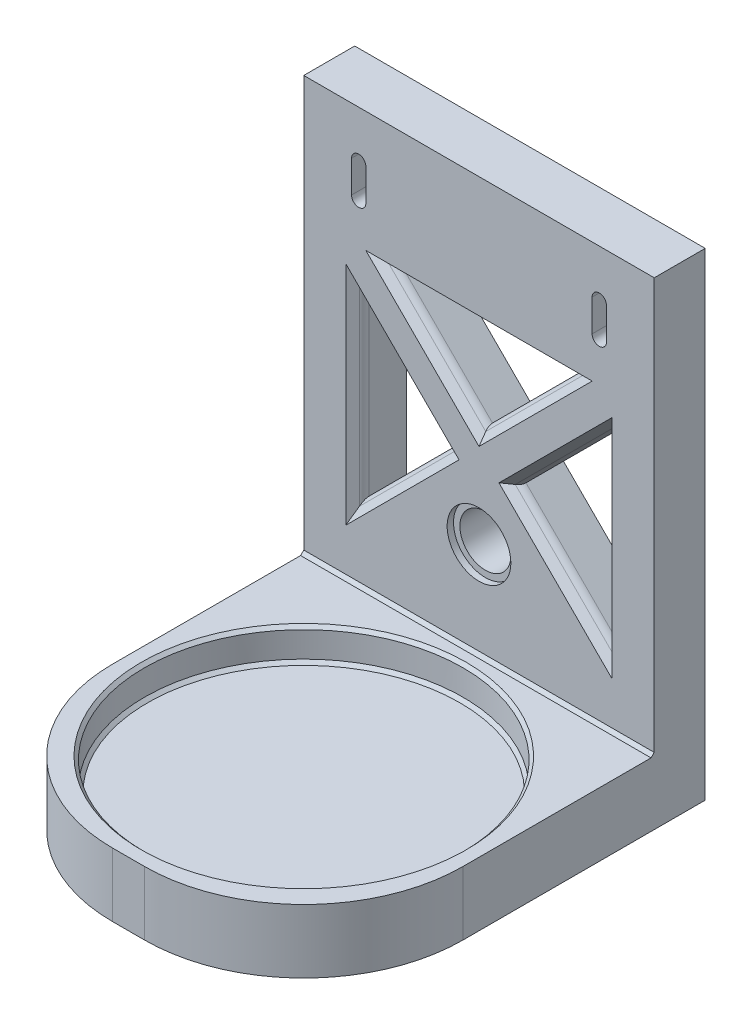
from build123d import *

# Parameters (mm, degrees)
SKETCH1_W           = 110
SKETCH1_H           = 150
BOSS_EXTRUDE1_DEPTH = 16
SKETCH4_W           = 110
SKETCH4_H           = 110
BOSS_EXTRUDE2_DEPTH = 20
SKETCH6_R           = 50
CUT_EXTRUDE1_DEPTH  = 10
FILLET1_R           = 50
SKETCH7_R           = 8
CUT_EXTRUDE4_DEPTH  = 194.971647413
SKETCH5_R           = 10
CUT_EXTRUDE5_DEPTH  = 2
CHAMFER3_SIZE       = 1
CHAMFER4_SIZE       = 1
CUT_EXTRUDE7_DEPTH  = 194.971647413
CHAMFER6_SIZE       = 3
FILLET3_R           = 3


with BuildPart() as part:
    # Sketch1 → Boss-Extrude1 (new body)
    with BuildSketch(Plane.XY):
        with Locations((0, 75)):
            Rectangle(SKETCH1_W, SKETCH1_H)
        with BuildLine():
            Line((-35.5, 135), (-35.5, 125))
            ThreePointArc((-35.5, 125), (-37.75, 122.75), (-40, 125))
            Line((-40, 125), (-40, 135))
            ThreePointArc((-40, 135), (-37.75, 137.25), (-35.5, 135))
        make_face(mode=Mode.SUBTRACT)
        with BuildLine():
            Line((35.5, 135), (35.5, 125))
            ThreePointArc((35.5, 125), (37.75, 122.75), (40, 125))
            Line((40, 125), (40, 135))
            ThreePointArc((40, 135), (37.75, 137.25), (35.5, 135))
        make_face(mode=Mode.SUBTRACT)
    extrude(amount=BOSS_EXTRUDE1_DEPTH)

    # Sketch4 → Boss-Extrude2 (add)
    with BuildSketch(Plane(origin=(0, 0, 0), x_dir=(1, 0, 0), z_dir=(0, 1, 0))):
        with Locations((0, -71)):
            Rectangle(SKETCH4_W, SKETCH4_H)
    extrude(amount=BOSS_EXTRUDE2_DEPTH)

    # Sketch6 → Cut-Extrude1 (cut)
    with BuildSketch(Plane(origin=(0, 20, 0), x_dir=(1, 0, 0), z_dir=(0, 1, 0))):
        with Locations(Location((0, -71, 0), (0, 0, 270))):
            Circle(SKETCH6_R)
    extrude(amount=-CUT_EXTRUDE1_DEPTH, mode=Mode.SUBTRACT)

    # Fillet1
    fillet1_edges = [part.edges().sort_by_distance(p)[0] for p in [
        (-55, 10, 126),
        (55, 10, 126),
    ]]
    fillet(fillet1_edges, radius=FILLET1_R)

    # Sketch7 → Cut-Extrude4 (cut, through all)
    with BuildSketch(Plane.XY.offset(16)):
        with Locations((0, 50)):
            Circle(SKETCH7_R)
    extrude(amount=-CUT_EXTRUDE4_DEPTH, mode=Mode.SUBTRACT)

    # Sketch5 → Cut-Extrude5 (cut)
    with BuildSketch(Plane.XY.offset(16)):
        with Locations((0, 50)):
            Circle(SKETCH5_R)
    extrude(amount=-CUT_EXTRUDE5_DEPTH, mode=Mode.SUBTRACT)

    # Chamfer3
    chamfer3_edges = [part.edges().sort_by_distance(p)[0] for p in [
        (0, 20, 16),
    ]]
    chamfer(chamfer3_edges, length=CHAMFER3_SIZE)

    # Chamfer4
    chamfer4_edges = [part.edges().sort_by_distance(p)[0] for p in [
        (0, 10, 21),
        (0, 20, 21),
    ]]
    chamfer(chamfer4_edges, length=CHAMFER4_SIZE)

    # Sketch8 → Cut-Extrude7 (cut, through all)
    with BuildSketch(Plane.XY.offset(16)):
        Polygon((-38.790019507, 98.174483069), (-10.505748259, 69.890211821), (-38.790019507, 41.605940574), align=None)
        Polygon((10.505748259, 69.890211821), (38.790019507, 41.605940574), (38.790019507, 98.174483069), align=None)
        Polygon((28.284271247, 109.186355869), (0, 80.902084621), (-28.284271247, 109.186355869), align=None)
    extrude(amount=-CUT_EXTRUDE7_DEPTH, mode=Mode.SUBTRACT)

    # Chamfer6
    chamfer6_edges = [part.edges().sort_by_distance(p)[0] for p in [
        (24.647883883, 84.032347445, 16),
        (24.647883883, 55.748076198, 16),
        (38.790019507, 69.890211821, 16),
        (0, 109.186355869, 16),
        (-14.142135624, 95.044220245, 16),
        (14.142135624, 95.044220245, 16),
        (-38.790019507, 69.890211821, 16),
        (-24.647883883, 55.748076198, 16),
        (-24.647883883, 84.032347445, 16),
    ]]
    chamfer(chamfer6_edges, length=CHAMFER6_SIZE)

    # Fillet3
    fillet3_edges = [part.edges().sort_by_distance(p)[0] for p in [
        (24.647883883, 55.748076198, 13),
        (38.790019507, 69.890211821, 13),
        (24.647883883, 84.032347445, 13),
        (-24.647883883, 55.748076198, 13),
        (-24.647883883, 84.032347445, 13),
        (-38.790019507, 69.890211821, 13),
        (-14.142135624, 95.044220245, 13),
        (14.142135624, 95.044220245, 13),
        (0, 109.186355869, 13),
    ]]
    fillet(fillet3_edges, radius=FILLET3_R)


solid = part.part
